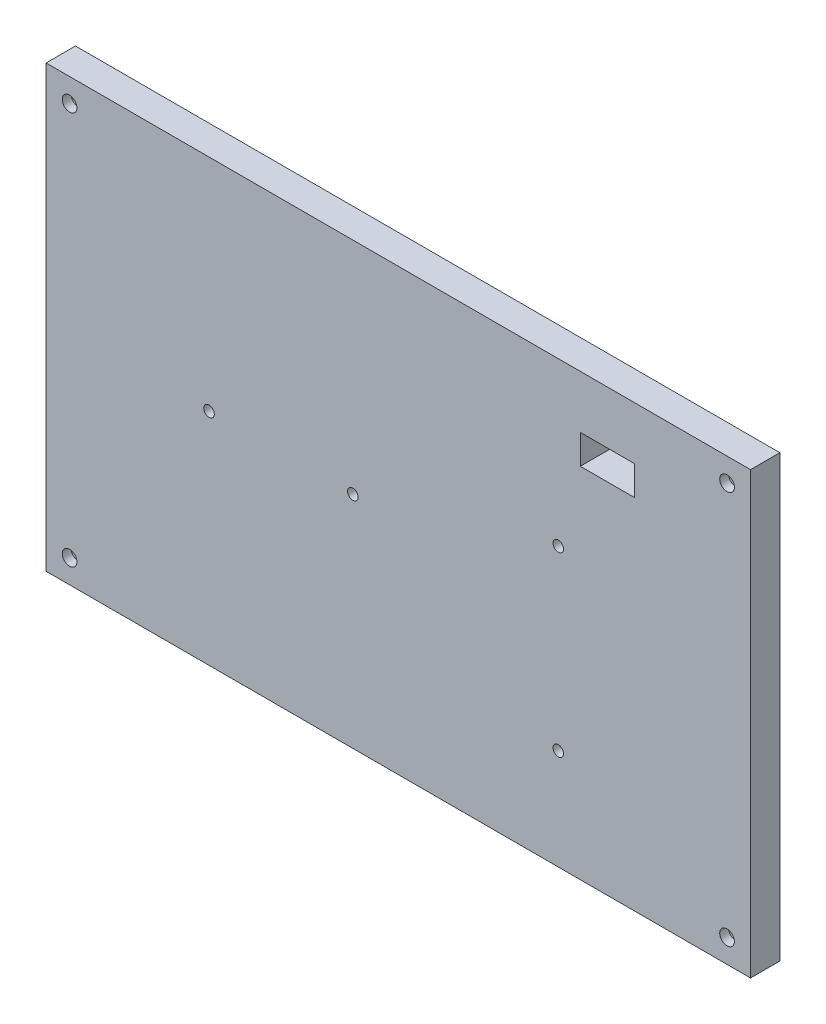
from build123d import *

# Parameters (mm, degrees)
SKETCH_1_W          = 120
SKETCH_1_H          = 75
EXTRUDE_1_DEPTH     = 5
SKETCH_2_R          = 1.25
CUT_EXTRUDE_1_DEPTH = 126.822295322
SKETCH_2_3_R        = 2
CUT_EXTRUDE_2_DEPTH = 3.5
SKETCH_3_W          = 9.2
SKETCH_3_H          = 5
CUT_EXTRUDE_3_DEPTH = 126.822295322
SKETCH_4_R          = 0.9
CUT_EXTRUDE_4_DEPTH = 126.822295322
SKETCH_5_R          = 0.9
CUT_EXTRUDE_5_DEPTH = 126.822295322


with BuildPart() as part:
    # 草图1 → 凸台-拉伸1 (new body)
    with BuildSketch(Plane.XY):
        with Locations((-60, 0)):
            Rectangle(SKETCH_1_W, SKETCH_1_H)
    extrude(amount=EXTRUDE_1_DEPTH)

    # 草图2 → 切除-拉伸1 (cut, through all)
    with BuildSketch(Plane(origin=(0, 0, 0), x_dir=(-1, 0, 0), z_dir=(0, 0, -1))):
        with Locations((4, 33.5)):
            Circle(SKETCH_2_R)
        with Locations((4, -33.5)):
            Circle(SKETCH_2_R)
        with Locations((116, -33.5)):
            Circle(SKETCH_2_R)
        with Locations((116, 33.5)):
            Circle(SKETCH_2_R)
    extrude(amount=-CUT_EXTRUDE_1_DEPTH, mode=Mode.SUBTRACT)

    # 草图2<3> → 切除-拉伸2 (cut)
    with BuildSketch(Plane(origin=(0, 0, 0), x_dir=(-1, 0, 0), z_dir=(0, 0, -1))):
        with Locations((4, 33.5)):
            Circle(SKETCH_2_3_R)
        with Locations((116, 33.5)):
            Circle(SKETCH_2_3_R)
        with Locations((4, -33.5)):
            Circle(SKETCH_2_3_R)
        with Locations((116, -33.5)):
            Circle(SKETCH_2_3_R)
    extrude(amount=-CUT_EXTRUDE_2_DEPTH, mode=Mode.SUBTRACT)

    # 草图3 → 切除-拉伸3 (cut, through all)
    with BuildSketch(Plane(origin=(0, 0, 0), x_dir=(-1, 0, 0), z_dir=(0, 0, -1))):
        with Locations((24.4, 26)):
            Rectangle(SKETCH_3_W, SKETCH_3_H)
    extrude(amount=-CUT_EXTRUDE_3_DEPTH, mode=Mode.SUBTRACT)

    # 草图4 → 切除-拉伸4 (cut, through all)
    with BuildSketch(Plane.XY.offset(5)):
        with Locations((-92.25, 0)):
            Circle(SKETCH_4_R)
        with Locations((-67.75, 0)):
            Circle(SKETCH_4_R)
    extrude(amount=-CUT_EXTRUDE_4_DEPTH, mode=Mode.SUBTRACT)

    # 草图5 → 切除-拉伸5 (cut, through all)
    with BuildSketch(Plane.XY.offset(5)):
        with Locations((-32.75, 9.85)):
            Circle(SKETCH_5_R)
        with Locations((-32.75, -20.35)):
            Circle(SKETCH_5_R)
    extrude(amount=-CUT_EXTRUDE_5_DEPTH, mode=Mode.SUBTRACT)


solid = part.part
